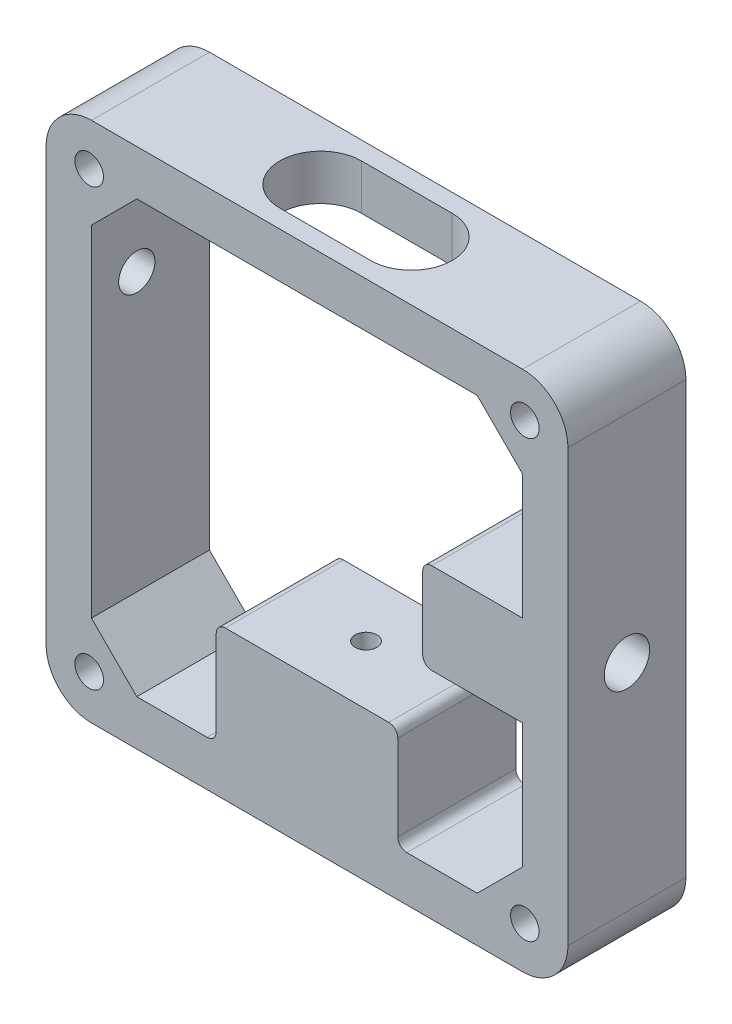
from build123d import *

# Parameters (mm, degrees)
SKETCH1_W           = 115
SKETCH1_H           = 115
SKETCH1_W_2         = 95
SKETCH1_H_2         = 95
BOSS_EXTRUDE1_DEPTH = 26
SKETCH10_W          = 40
SKETCH10_H          = 26
BOSS_EXTRUDE4_DEPTH = 27
SKETCH3_W           = 15
SKETCH3_H           = 15
CUT_EXTRUDE1_DEPTH  = 24
FILLET1_R           = 10
CHAMFER1_SIZE       = 10
SKETCH4_R           = 3.15
CUT_EXTRUDE3_DEPTH  = 57.5
SKETCH9_R           = 4
CUT_EXTRUDE7_DEPTH  = 30
FILLET5_R           = 2
SKETCH11_W          = 26
SKETCH11_H          = 20
BOSS_EXTRUDE5_DEPTH = 25
FILLET6_R           = 2
SKETCH13_R          = 5
CUT_EXTRUDE9_DEPTH  = 25
SKETCH14_R          = 2.5
CUT_EXTRUDE10_DEPTH = 15
CUT_EXTRUDE11_DEPTH = 10
SKETCH16_R          = 2.4
CUT_EXTRUDE12_DEPTH = 30


with BuildPart() as part:
    # Sketch1 → Boss-Extrude1 (new body)
    with BuildSketch(Plane.XY.offset(-13)):
        Rectangle(SKETCH1_W, SKETCH1_H)
        Rectangle(SKETCH1_W_2, SKETCH1_H_2, mode=Mode.SUBTRACT)
    extrude(amount=BOSS_EXTRUDE1_DEPTH)

    # Sketch10 → Boss-Extrude4 (add)
    with BuildSketch(Plane(origin=(0, -24.638, 0), x_dir=(1, 0, 0), z_dir=(0, 1, 0))):
        Rectangle(SKETCH10_W, SKETCH10_H)
    extrude(amount=-BOSS_EXTRUDE4_DEPTH)

    # Sketch3 → Cut-Extrude1 (cut)
    with BuildSketch(Plane(origin=(0, -57.5, 0), x_dir=(-1, 0, 0), z_dir=(0, -1, 0))):
        Rectangle(SKETCH3_W, SKETCH3_H)
    extrude(amount=-CUT_EXTRUDE1_DEPTH, mode=Mode.SUBTRACT)

    # Fillet1
    fillet1_edges = [part.edges().sort_by_distance(p)[0] for p in [
        (-57.5, 57.5, 0),
        (57.5, 57.5, 0),
        (57.5, -57.5, 0),
        (-57.5, -57.5, 0),
    ]]
    fillet(fillet1_edges, radius=FILLET1_R)

    # Chamfer1
    chamfer1_edges = [part.edges().sort_by_distance(p)[0] for p in [
        (-47.5, 47.5, 0),
        (-47.5, -47.5, 0),
        (47.5, -47.5, 0),
        (47.5, 47.5, 0),
    ]]
    chamfer(chamfer1_edges, length=CHAMFER1_SIZE)

    # Sketch4 → Cut-Extrude3 (cut, symmetric)
    with BuildSketch(Plane.XY):
        with Locations(Location((-48, 48, 0), (0, 0, 180))):
            Circle(SKETCH4_R)
        with Locations(Location((48, 48, 0), (0, 0, 180))):
            Circle(SKETCH4_R)
        with Locations(Location((48, -48, 0), (0, 0, 180))):
            Circle(SKETCH4_R)
        with Locations(Location((-48, -48, 0), (0, 0, 180))):
            Circle(SKETCH4_R)
    extrude(amount=CUT_EXTRUDE3_DEPTH, both=True, mode=Mode.SUBTRACT)

    # Sketch9 → Cut-Extrude7 (cut)
    with BuildSketch(Plane.ZY.offset(57.5)):
        with Locations(Location((3, 23.6, 0), (0, 0, 270))):
            Circle(SKETCH9_R)
    extrude(amount=-CUT_EXTRUDE7_DEPTH, mode=Mode.SUBTRACT)

    # Fillet5
    fillet5_edges = [part.edges().sort_by_distance(p)[0] for p in [
        (20, -47.5, 0),
        (-20, -47.5, 0),
        (-20, -24.638, 0),
        (20, -24.638, 0),
    ]]
    fillet(fillet5_edges, radius=FILLET5_R)

    # Sketch11 → Boss-Extrude5 (add)
    with BuildSketch(Plane(origin=(25.5, 0, 0), x_dir=(0, 0, -1), z_dir=(1, 0, 0))):
        Rectangle(SKETCH11_W, SKETCH11_H)
    extrude(amount=BOSS_EXTRUDE5_DEPTH)

    # Fillet6
    fillet6_edges = [part.edges().sort_by_distance(p)[0] for p in [
        (25.5, -10, 0),
        (25.5, 10, 0),
    ]]
    fillet(fillet6_edges, radius=FILLET6_R)

    # Sketch13 → Cut-Extrude9 (cut)
    with BuildSketch(Plane(origin=(57.5, 0, 0), x_dir=(0, 0, -1), z_dir=(1, 0, 0))):
        with Locations(Location((0, 0, 0), (0, 0, 90))):
            Circle(SKETCH13_R)
    extrude(amount=-CUT_EXTRUDE9_DEPTH, mode=Mode.SUBTRACT)

    # Sketch14 → Cut-Extrude10 (cut)
    with BuildSketch(Plane(origin=(25.5, 0, 0), x_dir=(0, 0, -1), z_dir=(1, 0, 0))):
        with Locations(Location((0, 0, 0), (0, 0, 180))):
            Circle(SKETCH14_R)
    extrude(amount=CUT_EXTRUDE10_DEPTH, mode=Mode.SUBTRACT)

    # Sketch15 → Cut-Extrude11 (cut)
    with BuildSketch(Plane(origin=(0, 57.5, 0), x_dir=(1, 0, 0), z_dir=(0, 1, 0))):
        with BuildLine():
            Line((-10, 9), (10, 9))
            ThreePointArc((10, 9), (19, 0), (10, -9))
            Line((10, -9), (-10, -9))
            ThreePointArc((-10, -9), (-19, 0), (-10, 9))
        make_face()
    extrude(amount=-CUT_EXTRUDE11_DEPTH, mode=Mode.SUBTRACT)

    # Sketch16 → Cut-Extrude12 (cut)
    with BuildSketch(Plane(origin=(0, -24.638, 0), x_dir=(1, 0, 0), z_dir=(0, 1, 0))):
        with Locations(Location((0, 0, 0), (0, 0, 270))):
            Circle(SKETCH16_R)
    extrude(amount=-CUT_EXTRUDE12_DEPTH, mode=Mode.SUBTRACT)


solid = part.part
